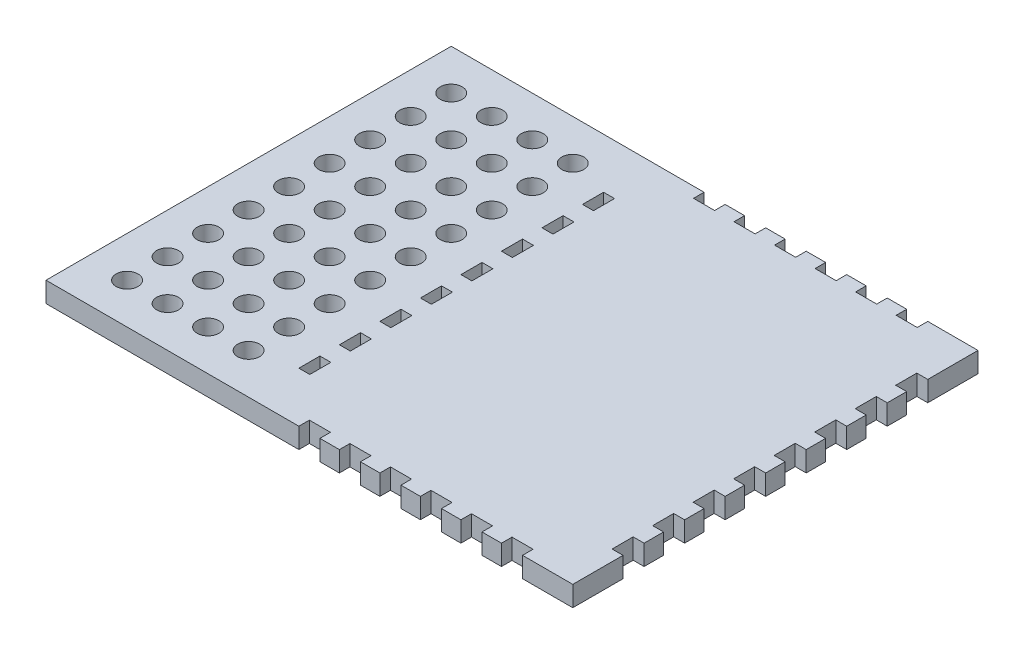
from build123d import *

# Parameters (mm, degrees)
SKETCH1_W           = 101.6
SKETCH1_H           = 127
BOSS_EXTRUDE1_DEPTH = 6.35
SKETCH2_W           = 6.604
SKETCH2_H           = 3.302
SKETCH2_W_2         = 3.429
SKETCH2_H_2         = 6.604
CUT_EXTRUDE1_DEPTH  = 82.567226875
SKETCH3_W           = 63.5
SKETCH3_H           = 127
SKETCH3_R           = 3.429
BOSS_EXTRUDE2_DEPTH = 6.35


with BuildPart() as part:
    # Sketch1 → Boss-Extrude1 (new body)
    with BuildSketch(Plane(origin=(0, 0, 0), x_dir=(1, 0, 0), z_dir=(0, 1, 0))):
        Rectangle(SKETCH1_W, SKETCH1_H)
    extrude(amount=BOSS_EXTRUDE1_DEPTH)

    # Sketch2 → Cut-Extrude1 (cut, through all)
    with BuildSketch(Plane(origin=(0, 6.35, 0), x_dir=(1, 0, 0), z_dir=(0, 1, 0))):
        with Locations((-31.75, -61.849)):
            Rectangle(SKETCH2_W, SKETCH2_H)
        with Locations((-19.05, -61.849)):
            Rectangle(SKETCH2_W, SKETCH2_H)
        with Locations((-6.35, -61.849)):
            Rectangle(SKETCH2_W, SKETCH2_H)
        with Locations((6.35, -61.849)):
            Rectangle(SKETCH2_W, SKETCH2_H)
        with Locations((19.05, -61.849)):
            Rectangle(SKETCH2_W, SKETCH2_H)
        with Locations((31.75, -61.849)):
            Rectangle(SKETCH2_W, SKETCH2_H)
        with Locations((31.75, 61.849)):
            Rectangle(SKETCH2_W, SKETCH2_H)
        with Locations((19.05, 61.849)):
            Rectangle(SKETCH2_W, SKETCH2_H)
        with Locations((6.35, 61.849)):
            Rectangle(SKETCH2_W, SKETCH2_H)
        with Locations((-6.35, 61.849)):
            Rectangle(SKETCH2_W, SKETCH2_H)
        with Locations((-19.05, 61.849)):
            Rectangle(SKETCH2_W, SKETCH2_H)
        with Locations((-31.75, 61.849)):
            Rectangle(SKETCH2_W, SKETCH2_H)
        with Locations((-49.0855, 31.75)):
            Rectangle(SKETCH2_W_2, SKETCH2_H_2)
        with Locations((-49.0855, 19.05)):
            Rectangle(SKETCH2_W_2, SKETCH2_H_2)
        with Locations((-49.0855, 6.35)):
            Rectangle(SKETCH2_W_2, SKETCH2_H_2)
        with Locations((-49.0855, -6.35)):
            Rectangle(SKETCH2_W_2, SKETCH2_H_2)
        with Locations((-49.0855, -19.05)):
            Rectangle(SKETCH2_W_2, SKETCH2_H_2)
        with Locations((-49.0855, -31.75)):
            Rectangle(SKETCH2_W_2, SKETCH2_H_2)
        with Locations((49.0855, -31.75)):
            Rectangle(SKETCH2_W_2, SKETCH2_H_2)
        with Locations((49.0855, -19.05)):
            Rectangle(SKETCH2_W_2, SKETCH2_H_2)
        with Locations((49.0855, -6.35)):
            Rectangle(SKETCH2_W_2, SKETCH2_H_2)
        with Locations((49.0855, 6.35)):
            Rectangle(SKETCH2_W_2, SKETCH2_H_2)
        with Locations((49.0855, 19.05)):
            Rectangle(SKETCH2_W_2, SKETCH2_H_2)
        with Locations((49.0855, 31.75)):
            Rectangle(SKETCH2_W_2, SKETCH2_H_2)
        with Locations((-49.0855, 44.45)):
            Rectangle(SKETCH2_W_2, SKETCH2_H_2)
        with Locations((-49.0855, -44.45)):
            Rectangle(SKETCH2_W_2, SKETCH2_H_2)
        with Locations((49.0855, -44.45)):
            Rectangle(SKETCH2_W_2, SKETCH2_H_2)
        with Locations((49.0855, 44.45)):
            Rectangle(SKETCH2_W_2, SKETCH2_H_2)
    extrude(amount=-CUT_EXTRUDE1_DEPTH, mode=Mode.SUBTRACT)

    # Sketch3 → Boss-Extrude2 (add)
    with BuildSketch(Plane(origin=(0, 6.35, 0), x_dir=(1, 0, 0), z_dir=(0, 1, 0))):
        with Locations((-82.55, 0)):
            Rectangle(SKETCH3_W, SKETCH3_H)
        with Locations(Location((-101.6, 50.8, 0), (0, 0, 270))):
            Circle(SKETCH3_R, mode=Mode.SUBTRACT)
        with Locations(Location((-88.9, 50.8, 0), (0, 0, 270))):
            Circle(SKETCH3_R, mode=Mode.SUBTRACT)
        with Locations(Location((-88.9, 38.1, 0), (0, 0, 270))):
            Circle(SKETCH3_R, mode=Mode.SUBTRACT)
        with Locations(Location((-101.6, 38.1, 0), (0, 0, 270))):
            Circle(SKETCH3_R, mode=Mode.SUBTRACT)
        with Locations(Location((-101.6, 25.4, 0), (0, 0, 270))):
            Circle(SKETCH3_R, mode=Mode.SUBTRACT)
        with Locations(Location((-88.9, 25.4, 0), (0, 0, 270))):
            Circle(SKETCH3_R, mode=Mode.SUBTRACT)
        with Locations(Location((-76.2, 50.8, 0), (0, 0, 270))):
            Circle(SKETCH3_R, mode=Mode.SUBTRACT)
        with Locations(Location((-63.5, 50.8, 0), (0, 0, 270))):
            Circle(SKETCH3_R, mode=Mode.SUBTRACT)
        with Locations(Location((-76.2, 38.1, 0), (0, 0, 270))):
            Circle(SKETCH3_R, mode=Mode.SUBTRACT)
        with Locations(Location((-63.5, 38.1, 0), (0, 0, 270))):
            Circle(SKETCH3_R, mode=Mode.SUBTRACT)
        with Locations(Location((-76.2, 25.4, 0), (0, 0, 270))):
            Circle(SKETCH3_R, mode=Mode.SUBTRACT)
        with Locations(Location((-63.5, 25.4, 0), (0, 0, 270))):
            Circle(SKETCH3_R, mode=Mode.SUBTRACT)
        with Locations(Location((-101.6, 12.7, 0), (0, 0, 270))):
            Circle(SKETCH3_R, mode=Mode.SUBTRACT)
        with Locations(Location((-88.9, 12.7, 0), (0, 0, 270))):
            Circle(SKETCH3_R, mode=Mode.SUBTRACT)
        with Locations(Location((-76.2, 12.7, 0), (0, 0, 270))):
            Circle(SKETCH3_R, mode=Mode.SUBTRACT)
        with Locations(Location((-63.5, 12.7, 0), (0, 0, 270))):
            Circle(SKETCH3_R, mode=Mode.SUBTRACT)
        with Locations(Location((-101.6, 0, 0), (0, 0, 270))):
            Circle(SKETCH3_R, mode=Mode.SUBTRACT)
        with Locations(Location((-88.9, 0, 0), (0, 0, 270))):
            Circle(SKETCH3_R, mode=Mode.SUBTRACT)
        with Locations(Location((-76.2, 0, 0), (0, 0, 270))):
            Circle(SKETCH3_R, mode=Mode.SUBTRACT)
        with Locations(Location((-63.5, 0, 0), (0, 0, 270))):
            Circle(SKETCH3_R, mode=Mode.SUBTRACT)
        with Locations(Location((-101.6, -12.7, 0), (0, 0, 270))):
            Circle(SKETCH3_R, mode=Mode.SUBTRACT)
        with Locations(Location((-88.9, -12.7, 0), (0, 0, 270))):
            Circle(SKETCH3_R, mode=Mode.SUBTRACT)
        with Locations(Location((-76.2, -12.7, 0), (0, 0, 270))):
            Circle(SKETCH3_R, mode=Mode.SUBTRACT)
        with Locations(Location((-63.5, -12.7, 0), (0, 0, 270))):
            Circle(SKETCH3_R, mode=Mode.SUBTRACT)
        with Locations(Location((-101.6, -25.4, 0), (0, 0, 270))):
            Circle(SKETCH3_R, mode=Mode.SUBTRACT)
        with Locations(Location((-88.9, -25.4, 0), (0, 0, 270))):
            Circle(SKETCH3_R, mode=Mode.SUBTRACT)
        with Locations(Location((-76.2, -25.4, 0), (0, 0, 270))):
            Circle(SKETCH3_R, mode=Mode.SUBTRACT)
        with Locations(Location((-63.5, -25.4, 0), (0, 0, 270))):
            Circle(SKETCH3_R, mode=Mode.SUBTRACT)
        with Locations(Location((-101.6, -38.1, 0), (0, 0, 270))):
            Circle(SKETCH3_R, mode=Mode.SUBTRACT)
        with Locations(Location((-88.9, -38.1, 0), (0, 0, 270))):
            Circle(SKETCH3_R, mode=Mode.SUBTRACT)
        with Locations(Location((-76.2, -38.1, 0), (0, 0, 270))):
            Circle(SKETCH3_R, mode=Mode.SUBTRACT)
        with Locations(Location((-63.5, -38.1, 0), (0, 0, 270))):
            Circle(SKETCH3_R, mode=Mode.SUBTRACT)
        with Locations(Location((-101.6, -50.8, 0), (0, 0, 270))):
            Circle(SKETCH3_R, mode=Mode.SUBTRACT)
        with Locations(Location((-88.9, -50.8, 0), (0, 0, 270))):
            Circle(SKETCH3_R, mode=Mode.SUBTRACT)
        with Locations(Location((-76.2, -50.8, 0), (0, 0, 270))):
            Circle(SKETCH3_R, mode=Mode.SUBTRACT)
        with Locations(Location((-63.5, -50.8, 0), (0, 0, 270))):
            Circle(SKETCH3_R, mode=Mode.SUBTRACT)
    extrude(amount=-BOSS_EXTRUDE2_DEPTH)


solid = part.part
